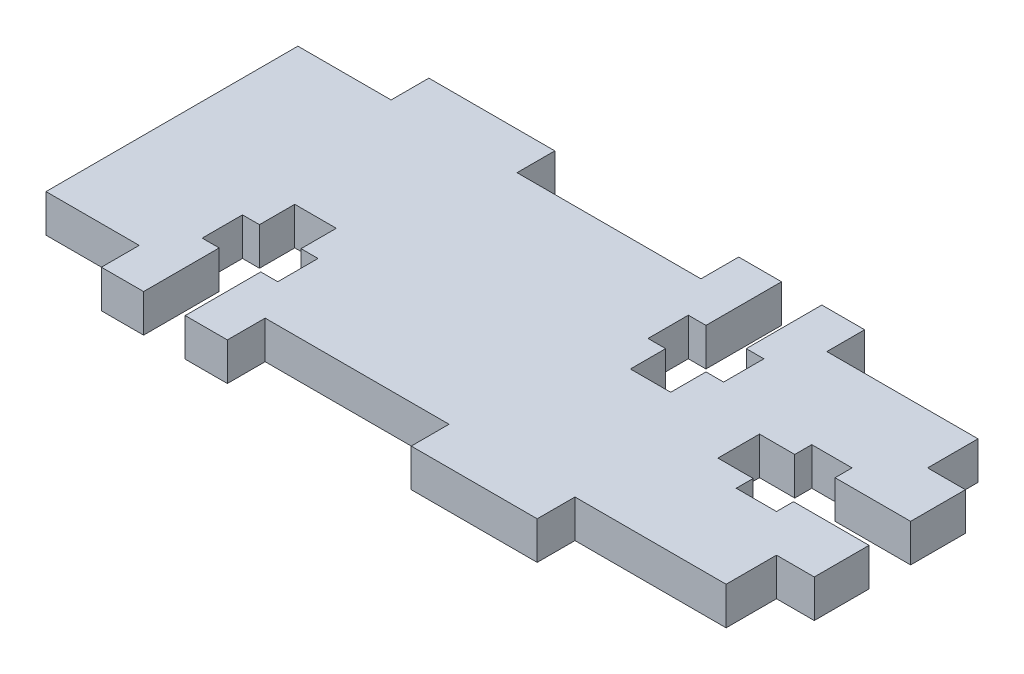
from build123d import *

# Parameters (mm, degrees)
SKETCH_1_W          = 34
SKETCH_1_H          = 20
SKETCH_1_W_2        = 3
SKETCH_1_H_2        = 12
SKETCH_1_W_3        = 10
SKETCH_1_H_3        = 3
EXTRUDE_1_DEPTH     = 3
SKETCH_2_W          = 2.8
SKETCH_2_H          = 3.3
SKETCH_2_W_2        = 3.2
SKETCH_2_H_2        = 1.35
SKETCH_2_W_3        = 6
CUT_EXTRUDE_1_DEPTH = 3
SKETCH_4_W          = 20
SKETCH_4_H          = 20
SKETCH_4_W_2        = 10
SKETCH_4_H_2        = 3
EXTRUDE_2_DEPTH     = 3
SKETCH_5_W          = 3.2
SKETCH_5_H          = 2.8
SKETCH_5_W_2        = 1.4
SKETCH_5_H_2        = 3.2
SKETCH_5_H_3        = 6
SKETCH_5_W_3        = 1.35
SKETCH_5_W_4        = 3.3
CUT_EXTRUDE_2_DEPTH = 3


with BuildPart() as part:
    # 草图1 → 凸台-拉伸1 (new body)
    with BuildSketch(Plane(origin=(0, 0, 0), x_dir=(1, 0, 0), z_dir=(0, 1, 0))):
        Rectangle(SKETCH_1_W, SKETCH_1_H)
        with Locations((18.5, 0)):
            Rectangle(SKETCH_1_W_2, SKETCH_1_H_2)
        with Locations((0, 11.5)):
            Rectangle(SKETCH_1_W_3, SKETCH_1_H_3)
        with Locations((0, -11.5)):
            Rectangle(SKETCH_1_W_3, SKETCH_1_H_3)
    extrude(amount=EXTRUDE_1_DEPTH)

    # 草图2 → 切除-拉伸1 (cut)
    with BuildSketch(Plane(origin=(0, 3, 0), x_dir=(1, 0, 0), z_dir=(0, 1, 0))):
        with Locations((9.4, 0)):
            Rectangle(SKETCH_2_W, SKETCH_2_H)
        with Locations((12.4, 2.325)):
            Rectangle(SKETCH_2_W_2, SKETCH_2_H_2)
        with Locations((12.4, 0)):
            Rectangle(SKETCH_2_W_2, SKETCH_2_H)
        with Locations((12.4, -2.325)):
            Rectangle(SKETCH_2_W_2, SKETCH_2_H_2)
        with Locations((17, 0)):
            Rectangle(SKETCH_2_W_3, SKETCH_2_H)
    extrude(amount=-CUT_EXTRUDE_1_DEPTH, mode=Mode.SUBTRACT)

    # 草图4 → 凸台-拉伸2 (add)
    with BuildSketch(Plane(origin=(0, 3, 0), x_dir=(1, 0, 0), z_dir=(0, 1, 0))):
        with Locations((-27, 0)):
            Rectangle(SKETCH_4_W, SKETCH_4_H)
        with Locations((-24.6, 11.5)):
            Rectangle(SKETCH_4_W_2, SKETCH_4_H_2)
        with Locations((-24.6, -11.5)):
            Rectangle(SKETCH_4_W_2, SKETCH_4_H_2)
    extrude(amount=-EXTRUDE_2_DEPTH)

    # 草图5 → 切除-拉伸2 (cut)
    with BuildSketch(Plane(origin=(0, 3, 0), x_dir=(1, 0, 0), z_dir=(0, 1, 0))):
        with Locations((0, 2.4)):
            Rectangle(SKETCH_5_W, SKETCH_5_H)
        with Locations((-2.3, 5.4)):
            Rectangle(SKETCH_5_W_2, SKETCH_5_H_2)
        with Locations((0, 10)):
            Rectangle(SKETCH_5_W, SKETCH_5_H_3)
        with Locations((0, 5.4)):
            Rectangle(SKETCH_5_W, SKETCH_5_H_2)
        with Locations((2.3, 5.4)):
            Rectangle(SKETCH_5_W_2, SKETCH_5_H_2)
        with Locations((-26.925, -5.4)):
            Rectangle(SKETCH_5_W_3, SKETCH_5_H_2)
        with Locations((-24.6, -2.4)):
            Rectangle(SKETCH_5_W_4, SKETCH_5_H)
        with Locations((-22.275, -5.4)):
            Rectangle(SKETCH_5_W_3, SKETCH_5_H_2)
        with Locations((-24.6, -5.4)):
            Rectangle(SKETCH_5_W_4, SKETCH_5_H_2)
        with Locations((-24.6, -10)):
            Rectangle(SKETCH_5_W_4, SKETCH_5_H_3)
    extrude(amount=-CUT_EXTRUDE_2_DEPTH, mode=Mode.SUBTRACT)


solid = part.part
